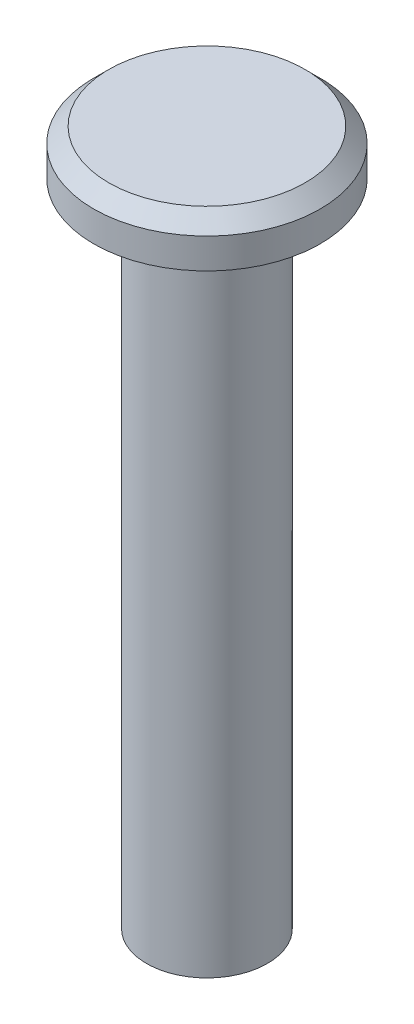
from build123d import *

# Parameters (mm, degrees)
SKETCH2_R           = 7.5
BOSS_EXTRUDE1_DEPTH = 3
SKETCH3_R           = 4
BOSS_EXTRUDE2_DEPTH = 43
CHAMFER1_SIZE       = 1


with BuildPart() as part:
    # Sketch2 → Boss-Extrude1 (new body)
    with BuildSketch(Plane(origin=(0, 0, 0), x_dir=(1, 0, 0), z_dir=(0, 1, 0))):
        with Locations(Location((0, 0, 0), (0, 0, 270))):
            Circle(SKETCH2_R)
    extrude(amount=BOSS_EXTRUDE1_DEPTH)

    # Sketch3 → Boss-Extrude2 (add)
    with BuildSketch(Plane.XZ):
        with Locations(Location((0, 0, 0), (0, 0, 270))):
            Circle(SKETCH3_R)
    extrude(amount=BOSS_EXTRUDE2_DEPTH)

    # Chamfer1
    chamfer1_edges = [part.edges().sort_by_distance(p)[0] for p in [
        (0, 3, -7.5),
    ]]
    chamfer(chamfer1_edges, length=CHAMFER1_SIZE)


solid = part.part
